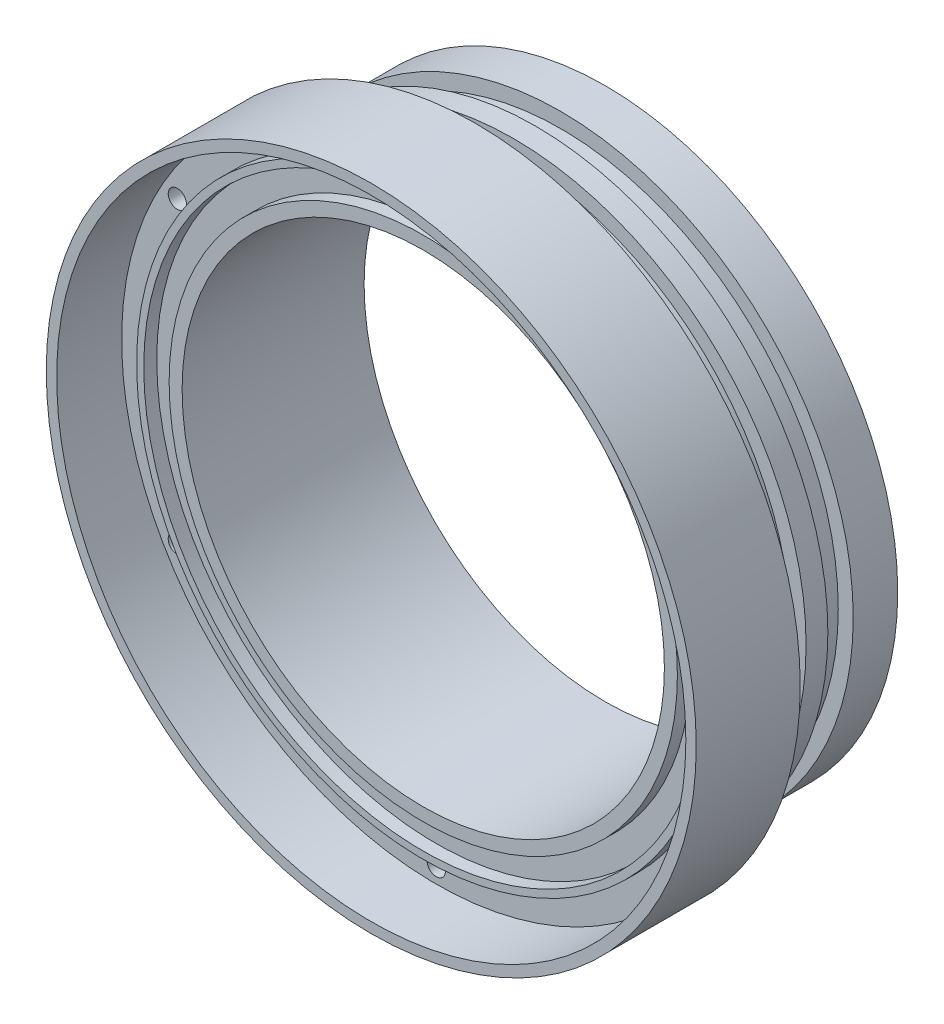
from build123d import *

# Parameters (mm, degrees)
SKETCH1_R           = 50
BOSS_EXTRUDE1_DEPTH = 28
SKETCH4_R           = 53.870598216
SKETCH4_R_2         = 45
CUT_EXTRUDE1_DEPTH  = 20
SKETCH5_R           = 37.1
CUT_EXTRUDE2_DEPTH  = 46.383141605
SKETCH6_R           = 43
SKETCH6_R_2         = 39.1
CUT_EXTRUDE3_DEPTH  = 2
SKETCH7_R           = 1.4
CUT_EXTRUDE4_DEPTH  = 7
EXTRUDE_THIN1_START = 8
SKETCH8_R           = 50
SKETCH8_R_2         = 48.4
EXTRUDE_THIN1_DEPTH = 8
SKETCH9_R           = 48.4
SKETCH9_R_2         = 44.1
SKETCH9_R_3         = 1.4
CUT_EXTRUDE5_DEPTH  = 2
SKETCH10_W          = 2.3
SKETCH10_H          = 3.9
SKETCH11_R          = 1.356303205
CUT_EXTRUDE7_DEPTH  = 5


with BuildPart() as part:
    # Sketch1 → Boss-Extrude1 (new body)
    with BuildSketch(Plane.XY):
        Circle(SKETCH1_R)
    extrude(amount=-BOSS_EXTRUDE1_DEPTH)

    # Sketch4 → Cut-Extrude1 (cut)
    with BuildSketch(Plane(origin=(0, 0, -28), x_dir=(-1, 0, 0), z_dir=(0, 0, -1))):
        Circle(SKETCH4_R)
        Circle(SKETCH4_R_2, mode=Mode.SUBTRACT)
    extrude(amount=-CUT_EXTRUDE1_DEPTH, mode=Mode.SUBTRACT)

    # Sketch5 → Cut-Extrude2 (cut)
    with BuildSketch(Plane(origin=(0, 0, -28), x_dir=(-1, 0, 0), z_dir=(0, 0, -1))):
        Circle(SKETCH5_R)
    extrude(amount=-CUT_EXTRUDE2_DEPTH, mode=Mode.SUBTRACT)

    # Sketch6 → Cut-Extrude3 (cut)
    with BuildSketch(Plane.XY):
        Circle(SKETCH6_R)
        Circle(SKETCH6_R_2, mode=Mode.SUBTRACT)
    extrude(amount=-CUT_EXTRUDE3_DEPTH, mode=Mode.SUBTRACT)

    # Sketch7 → Cut-Extrude4 (cut)
    with BuildSketch(Plane.XY):
        with Locations((0, 46)):
            Circle(SKETCH7_R)
        with Locations((39.837168574, 23)):
            Circle(SKETCH7_R)
        with Locations((39.837168574, -23)):
            Circle(SKETCH7_R)
        with Locations((0, -46)):
            Circle(SKETCH7_R)
        with Locations((-39.837168574, -23)):
            Circle(SKETCH7_R)
        with Locations((-39.837168574, 23)):
            Circle(SKETCH7_R)
    extrude(amount=-CUT_EXTRUDE4_DEPTH, mode=Mode.SUBTRACT)

    # Sketch8 → Extrude-Thin1 (add)
    with BuildSketch(Plane.XY.offset(EXTRUDE_THIN1_START)):
        Circle(SKETCH8_R)
        Circle(SKETCH8_R_2, mode=Mode.SUBTRACT)
    extrude(amount=-EXTRUDE_THIN1_DEPTH)

    # Sketch9 → Cut-Extrude5 (cut)
    with BuildSketch(Plane.XY):
        Circle(SKETCH9_R)
        Circle(SKETCH9_R_2, mode=Mode.SUBTRACT)
        with Locations((-39.837168574, -23)):
            Circle(SKETCH9_R_3, mode=Mode.SUBTRACT)
        with Locations((-39.837168574, 23)):
            Circle(SKETCH9_R_3, mode=Mode.SUBTRACT)
        with Locations((0, -46)):
            Circle(SKETCH9_R_3, mode=Mode.SUBTRACT)
        with Locations((0, 46)):
            Circle(SKETCH9_R_3, mode=Mode.SUBTRACT)
        with Locations((39.837168574, -23)):
            Circle(SKETCH9_R_3, mode=Mode.SUBTRACT)
        with Locations((39.837168574, 23)):
            Circle(SKETCH9_R_3, mode=Mode.SUBTRACT)
    extrude(amount=-CUT_EXTRUDE5_DEPTH, mode=Mode.SUBTRACT)

    # Sketch10 → Cut-Revolve1 (revolve, cut)
    with BuildSketch(Plane(origin=(0, 0, 0), x_dir=(1, 0, 0), z_dir=(0, 1, 0)), mode=Mode.PRIVATE) as cut_revolve1_sk:
        with Locations((-43.85, 11.95)):
            Rectangle(SKETCH10_W, SKETCH10_H)
        with Locations((-43.85, 19.201350281)):
            Rectangle(SKETCH10_W, SKETCH10_H)
    revolve(cut_revolve1_sk.sketch.rotate(Axis((0, 0, 0), (0, 0, -1)), 180), axis=Axis((0, 0, 0), (0, 0, -1)), mode=Mode.SUBTRACT)

    # Sketch11 → Cut-Extrude7 (cut)
    with BuildSketch(Plane(origin=(0, 0, -28), x_dir=(-1, 0, 0), z_dir=(0, 0, -1))):
        with Locations((0, 40.874722667)):
            Circle(SKETCH11_R)
        with Locations((40.874722667, 0)):
            Circle(SKETCH11_R)
        with Locations((0, -40.874722667)):
            Circle(SKETCH11_R)
        with Locations((-40.874722667, 0)):
            Circle(SKETCH11_R)
    extrude(amount=-CUT_EXTRUDE7_DEPTH, mode=Mode.SUBTRACT)


solid = part.part
